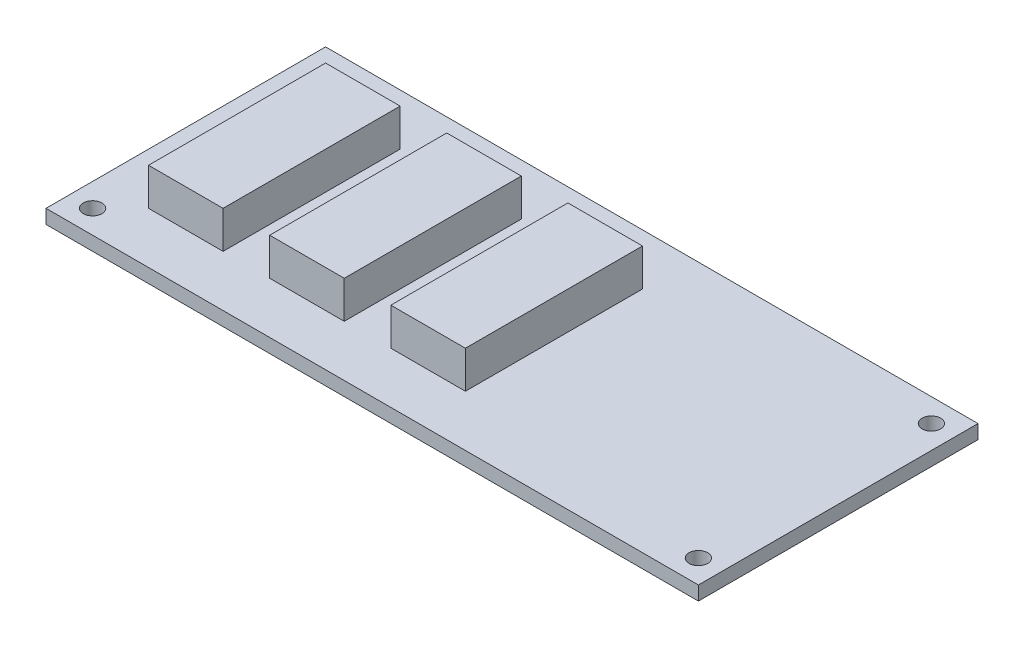
from build123d import *

# Parameters (mm, degrees)
SKETCH_1_W      = 70
SKETCH_1_H      = 30
SKETCH_1_R      = 1
EXTRUDE_1_DEPTH = 1.5
SKETCH_2_W      = 8
SKETCH_2_H      = 19
EXTRUDE_2_DEPTH = 4


with BuildPart() as part:
    # Эскиз1 → Бобышка-Вытянуть1 (new body)
    with BuildSketch(Plane(origin=(0, 0, 0), x_dir=(1, 0, 0), z_dir=(0, 1, 0))):
        Rectangle(SKETCH_1_W, SKETCH_1_H)
        with Locations(Location((-32.5, 12.5, 0), (0, 0, 270))):
            Circle(SKETCH_1_R, mode=Mode.SUBTRACT)
        with Locations(Location((32.5, 12.5, 0), (0, 0, 270))):
            Circle(SKETCH_1_R, mode=Mode.SUBTRACT)
        with Locations(Location((32.5, -12.5, 0), (0, 0, 270))):
            Circle(SKETCH_1_R, mode=Mode.SUBTRACT)
        with Locations(Location((-32.5, -12.5, 0), (0, 0, 270))):
            Circle(SKETCH_1_R, mode=Mode.SUBTRACT)
    extrude(amount=EXTRUDE_1_DEPTH)

    # Эскиз2 → Бобышка-Вытянуть2 (add)
    with BuildSketch(Plane(origin=(0, 1.5, 0), x_dir=(1, 0, 0), z_dir=(0, 1, 0))):
        with Locations((-25.5, 0)):
            Rectangle(SKETCH_2_W, SKETCH_2_H)
        with Locations((-12.5, 0)):
            Rectangle(SKETCH_2_W, SKETCH_2_H)
        with Locations((0.5, 0)):
            Rectangle(SKETCH_2_W, SKETCH_2_H)
    extrude(amount=EXTRUDE_2_DEPTH)


solid = part.part
